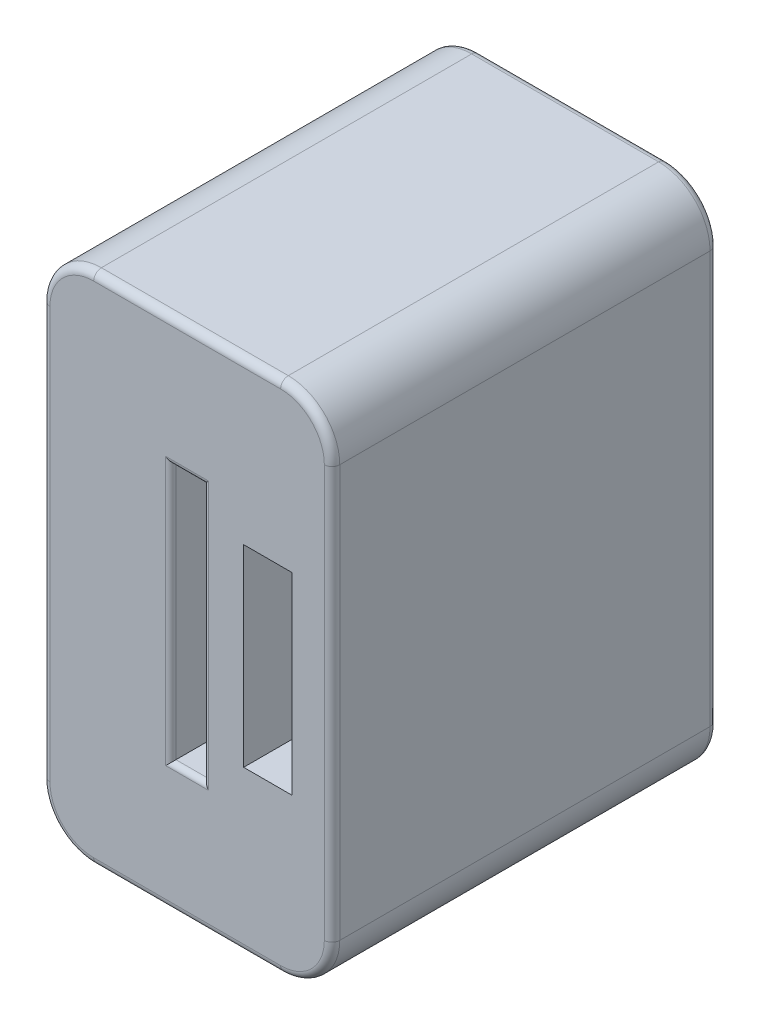
from build123d import *

# Parameters (mm, degrees)
SKETCH1_W           = 28.6258
SKETCH1_H           = 50.8508
SKETCH1_W_2         = 3.2258
SKETCH1_H_2         = 25.4508
BOSS_EXTRUDE1_DEPTH = 19.05
FILLET1_R           = 5.08
FILLET3_R           = 0.762
FILLET4_R           = 0.508
CUT_EXTRUDE1_DEPTH  = 3.175
CUT_EXTRUDE2_DEPTH  = 2.38125


with BuildPart() as part:
    # Sketch1 → Boss-Extrude1 (new, symmetric)
    with BuildSketch(Plane.XY):
        Rectangle(SKETCH1_W, SKETCH1_H)
        Rectangle(SKETCH1_W_2, SKETCH1_H_2, mode=Mode.SUBTRACT)
    extrude(amount=BOSS_EXTRUDE1_DEPTH, both=True)

    # Fillet1
    fillet1_edges = [part.edges().sort_by_distance(p)[0] for p in [
        (-14.3129, -25.4254, 0),
        (14.3129, -25.4254, 0),
        (-14.3129, 25.4254, 0),
        (14.3129, 25.4254, 0),
    ]]
    fillet(fillet1_edges, radius=FILLET1_R)

    # Fillet3
    fillet3_edges = [part.edges().sort_by_distance(p)[0] for p in [
        (12.825002448, -23.937502448, 19.05),
        (0, -25.4254, 19.05),
        (-12.825002448, -23.937502448, 19.05),
        (-14.3129, 0, 19.05),
        (-12.825002448, 23.937502448, 19.05),
        (0, 25.4254, 19.05),
        (12.825002448, 23.937502448, 19.05),
        (12.825002448, -23.937502448, -19.05),
        (0, -25.4254, -19.05),
        (-12.825002448, -23.937502448, -19.05),
        (-14.3129, 0, -19.05),
        (-12.825002448, 23.937502448, -19.05),
        (0, 25.4254, -19.05),
        (12.825002448, 23.937502448, -19.05),
        (14.3129, 0, 19.05),
        (14.3129, 0, -19.05),
    ]]
    fillet(fillet3_edges, radius=FILLET3_R)

    # Fillet4
    fillet4_edges = [part.edges().sort_by_distance(p)[0] for p in [
        (0, 12.7254, 19.05),
        (-1.6129, 0, 19.05),
        (0, -12.7254, 19.05),
        (1.6129, 0, 19.05),
        (0, -12.7254, -19.05),
        (1.6129, 0, -19.05),
        (0, 12.7254, -19.05),
        (-1.6129, 0, -19.05),
    ]]
    fillet(fillet4_edges, radius=FILLET4_R)

    # Sketch2 → Cut-Extrude1 (cut, symmetric)
    with BuildSketch(Plane(origin=(7.9629, 0, 0), x_dir=(0, 0, -1), z_dir=(1, 0, 0))):
        with BuildLine():
            ThreePointArc((9.525, 0), (6.735192091, 6.735192091), (0, 9.525))
            ThreePointArc((0, 9.525), (-9.525, 0), (0, -9.525))
            ThreePointArc((0, -9.525), (6.735192091, -6.735192091), (9.525, 0))
        make_face()
    extrude(amount=CUT_EXTRUDE1_DEPTH, both=True, mode=Mode.SUBTRACT)

    # Sketch2<3> → Cut-Extrude2 (cut, symmetric)
    with BuildSketch(Plane(origin=(7.9629, 0, 0), x_dir=(0, 0, -1), z_dir=(1, 0, 0))):
        with BuildLine():
            ThreePointArc((0, -9.525), (-9.525, 0), (0, 9.525))
            Line((0, 9.525), (-19.05, 9.525))
            Line((-19.05, 9.525), (-19.05, -9.525))
            Line((-19.05, -9.525), (0, -9.525))
        make_face()
    extrude(amount=CUT_EXTRUDE2_DEPTH, both=True, mode=Mode.SUBTRACT)


solid = part.part
